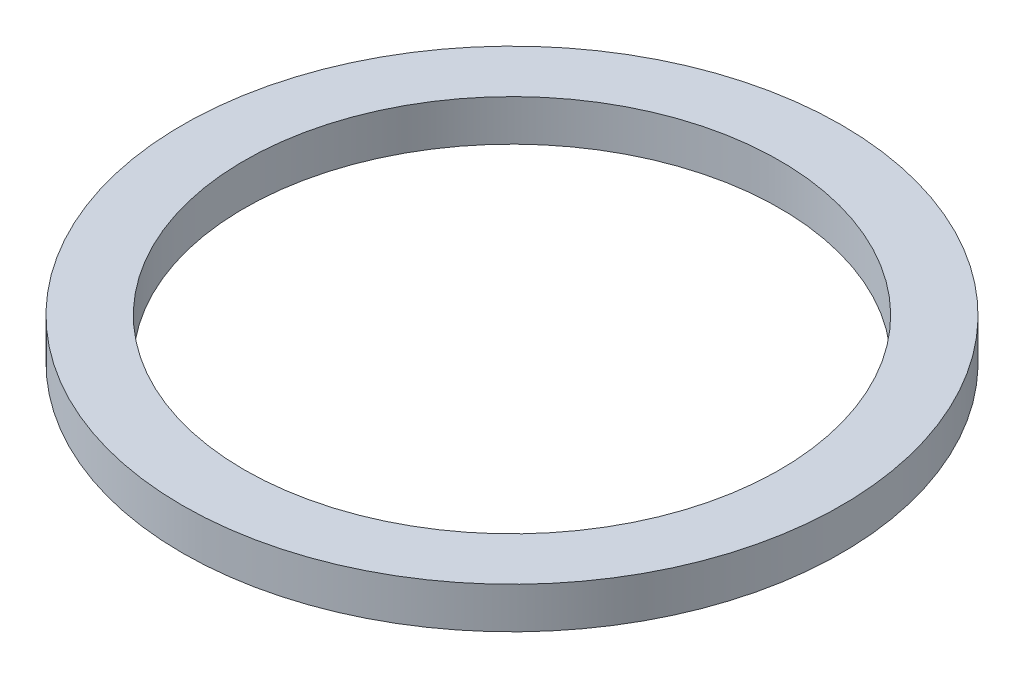
from build123d import *

# Parameters (mm, degrees)
SKETCH1_R           = 4
SKETCH1_R_2         = 3.25
BOSS_EXTRUDE1_DEPTH = 0.5


with BuildPart() as part:
    # Sketch1 → Boss-Extrude1 (new body)
    with BuildSketch(Plane(origin=(0, 0, 0), x_dir=(1, 0, 0), z_dir=(0, 1, 0))):
        with Locations(Location((0, 0, 0), (0, 0, 270))):
            Circle(SKETCH1_R)
        with Locations(Location((0, 0, 0), (0, 0, 270))):
            Circle(SKETCH1_R_2, mode=Mode.SUBTRACT)
    extrude(amount=BOSS_EXTRUDE1_DEPTH)


solid = part.part
